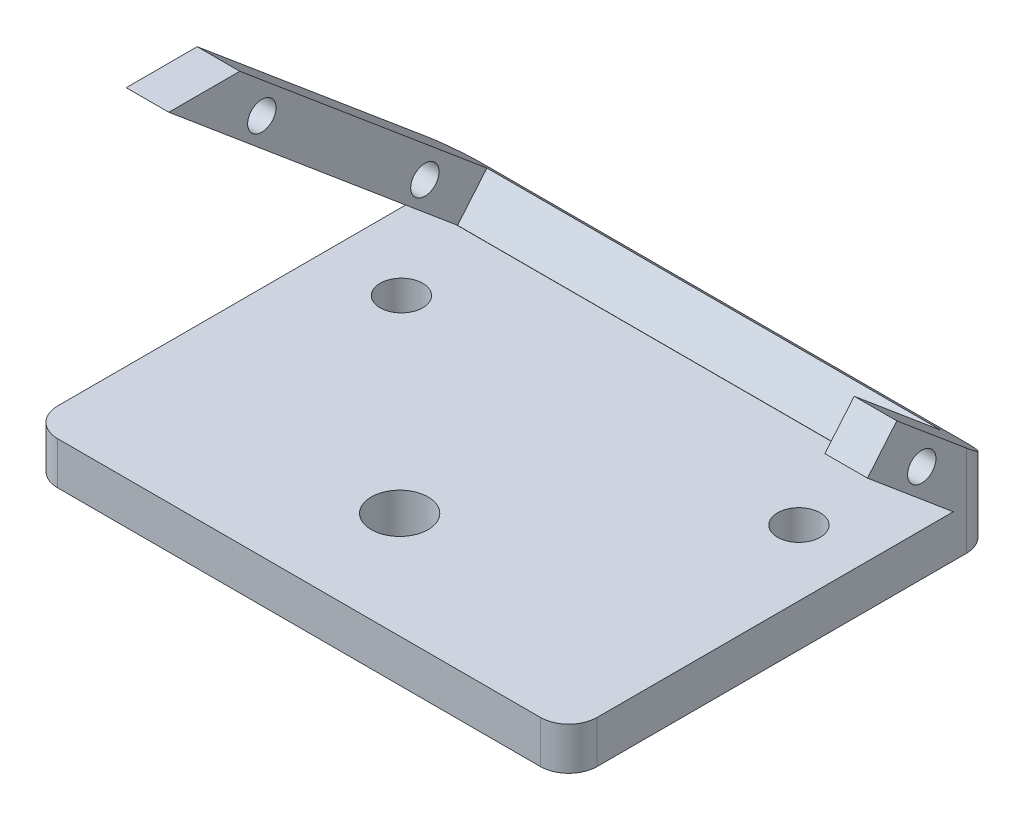
from build123d import *

# Parameters (mm, degrees)
SKETCH_1_W          = 38
SKETCH_1_H          = 30
EXTRUDE_1_DEPTH     = 20
SKETCH_2_OUTSIDE_W  = 42.476
SKETCH_2_OUTSIDE_H  = 32.476
CUT_EXTRUDE_1_DEPTH = 50.18334813
CUT_EXTRUDE_2_DEPTH = 3.213938048
SKETCH_5_R          = 1
CUT_EXTRUDE_3_DEPTH = 50.18334813
SKETCH_6_R          = 2
CUT_EXTRUDE_4_DEPTH = 41.211951058
SKETCH_7_R          = 1.5
CUT_EXTRUDE_5_DEPTH = 41.211951058
FILLET_1_R          = 2


with BuildPart() as part:
    # 草图1 → 凸台-拉伸1 (new body)
    with BuildSketch(Plane(origin=(0, 0, 0), x_dir=(1, 0, 0), z_dir=(0, 1, 0))):
        with Locations((-8.44083225, -8.979193758)):
            Rectangle(SKETCH_1_W, SKETCH_1_H)
    extrude(amount=EXTRUDE_1_DEPTH)

    # 草图2 outside → 切除-拉伸1 (cut, through all)
    with BuildSketch(Plane.ZY.offset(27.44083225)):
        with Locations((8.979, 10)):
            Rectangle(SKETCH_2_OUTSIDE_W, SKETCH_2_OUTSIDE_H)
        Polygon((23.979193758, 3), (-3.108138222, 3), (17.151672852, 20), (12.151672852, 20), (-6.020806242, 4.751479495), (-6.020806242, 0), (23.979193758, 0), align=None, mode=Mode.SUBTRACT)
    extrude(amount=-CUT_EXTRUDE_1_DEPTH, mode=Mode.SUBTRACT)

    # 草图4 → 切除-拉伸2 (cut)
    with BuildSketch(Plane(origin=(0, 5.752950958, -4.827299027), x_dir=(1, 0, 0), z_dir=(0, 0.7660444431189813, -0.6427876096865356))):
        Polygon((-24.44083225, -25.994695872), (-24.44083225, 0.558013018), (7.55916775, 0.558013018), (7.55916775, -7.441986982), (10.55916775, -7.441986982), (10.55916775, -25.994695872), align=None)
    extrude(amount=-CUT_EXTRUDE_2_DEPTH, mode=Mode.SUBTRACT)

    # 草图5 → 切除-拉伸3 (cut, through all)
    with BuildSketch(Plane.ZY.offset(27.44083225)):
        with Locations((-0.886376682, 6.863996586)):
            Circle(SKETCH_5_R)
        with Locations((10.599170775, 16.511908257)):
            Circle(SKETCH_5_R)
    extrude(amount=-CUT_EXTRUDE_3_DEPTH, mode=Mode.SUBTRACT)

    # 草图6 → 切除-拉伸4 (cut, through all)
    with BuildSketch(Plane(origin=(0, 3, 0), x_dir=(1, 0, 0), z_dir=(0, 1, 0))):
        with Locations(Location((-8.84513683, -16.485782133, 0), (0, 0, 270))):
            Circle(SKETCH_6_R)
    extrude(amount=-CUT_EXTRUDE_4_DEPTH, mode=Mode.SUBTRACT)

    # 草图7 → 切除-拉伸5 (cut, through all)
    with BuildSketch(Plane(origin=(0, 3, 0), x_dir=(1, 0, 0), z_dir=(0, 1, 0))):
        with Locations(Location((-22.069088403, -3.139744133, 0), (0, 0, 270))):
            Circle(SKETCH_7_R)
        with Locations(Location((5.930911597, -3.139744133, 0), (0, 0, 270))):
            Circle(SKETCH_7_R)
    extrude(amount=-CUT_EXTRUDE_5_DEPTH, mode=Mode.SUBTRACT)

    # 圆角1
    fillet_1_edges = [part.edges().sort_by_distance(p)[0] for p in [
        (-27.44083225, 2.375739747, -6.020806242),
        (10.55916775, 2.375739747, -6.020806242),
        (10.55916775, 1.5, 23.979193758),
        (-27.44083225, 1.5, 23.979193758),
    ]]
    fillet(fillet_1_edges, radius=FILLET_1_R)


solid = part.part
